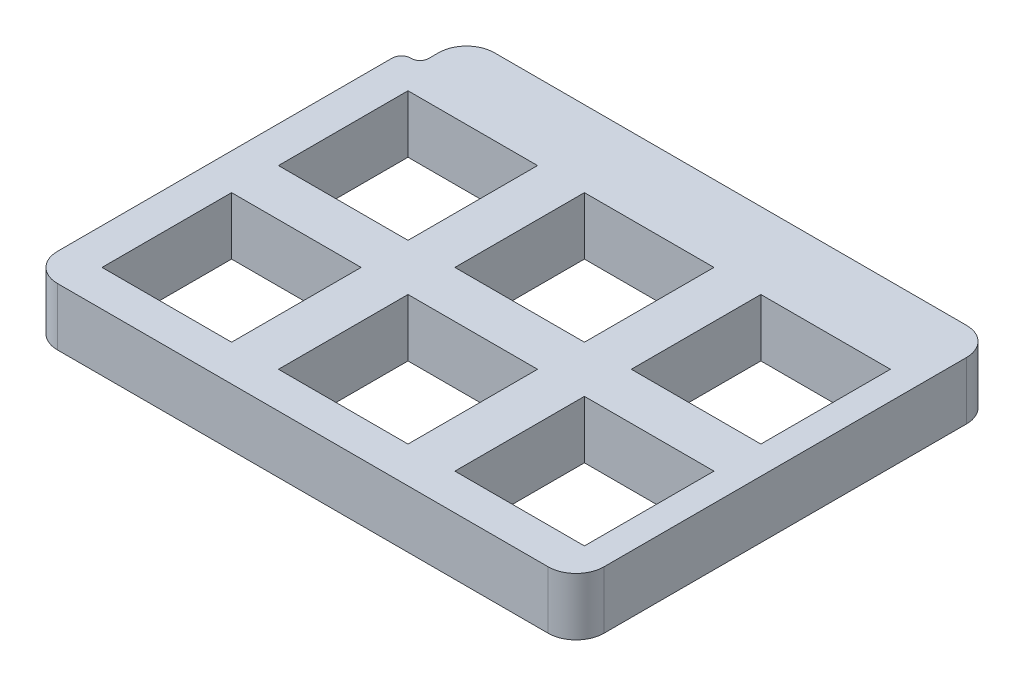
from build123d import *

# Parameters (mm, degrees)
SKETCH1_W           = 13.95
SKETCH1_H           = 13.95
BOSS_EXTRUDE1_DEPTH = 6.2


with BuildPart() as part:
    # Sketch1 → Boss-Extrude1 (new body)
    with BuildSketch(Plane(origin=(0, 0, 0), x_dir=(1, 0, 0), z_dir=(0, 1, 0))):
        with BuildLine():
            Line((5, 0), (55.85, 0))
            ThreePointArc((55.85, 0), (57.971320344, -0.878679656), (58.85, -3))
            Line((58.85, -3), (58.85, -42.05))
            ThreePointArc((58.85, -42.05), (57.971320344, -44.171320344), (55.85, -45.05))
            Line((55.85, -45.05), (3, -45.05))
            ThreePointArc((3, -45.05), (0.878679656, -44.171320344), (0, -42.05))
            Line((0, -42.05), (0, -6))
            ThreePointArc((0, -6), (0.292893219, -5.292893219), (1, -5))
            Line((1, -5), (1.1, -5))
            ThreePointArc((1.1, -5), (1.736396103, -4.736396103), (2, -4.1))
            Line((2, -4.1), (2, -3))
            ThreePointArc((2, -3), (2.878679656, -0.878679656), (5, 0))
        make_face()
        with Locations((29.875, -15.175)):
            Rectangle(SKETCH1_W, SKETCH1_H, mode=Mode.SUBTRACT)
        with Locations((10.875, -15.175)):
            Rectangle(SKETCH1_W, SKETCH1_H, mode=Mode.SUBTRACT)
        with Locations((48.875, -15.175)):
            Rectangle(SKETCH1_W, SKETCH1_H, mode=Mode.SUBTRACT)
        with Locations((29.875, -34.175)):
            Rectangle(SKETCH1_W, SKETCH1_H, mode=Mode.SUBTRACT)
        with Locations((48.875, -34.175)):
            Rectangle(SKETCH1_W, SKETCH1_H, mode=Mode.SUBTRACT)
        with Locations((10.875, -34.175)):
            Rectangle(SKETCH1_W, SKETCH1_H, mode=Mode.SUBTRACT)
    extrude(amount=BOSS_EXTRUDE1_DEPTH)


solid = part.part
